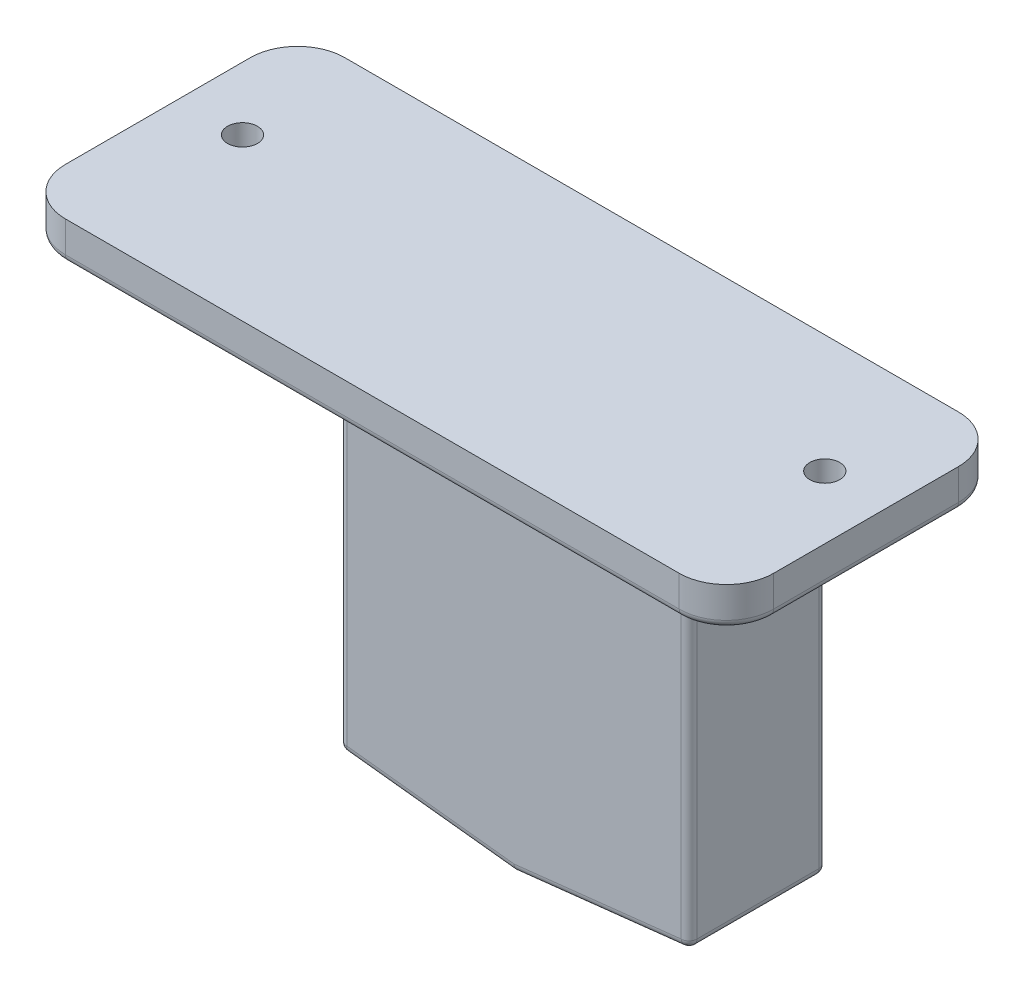
from build123d import *

# Parameters (mm, degrees)
AUFSATZ_LINEAR_AUSTRAGEN1_DEPTH  = 15
SCHNITT_LINEAR_AUSTRAGEN5_DEPTH  = 20.5
SCHNITT_LINEAR_AUSTRAGEN5_DRAFT  = -4
AUFSATZ_LINEAR_AUSTRAGEN4_DEPTH  = 2.5
SKIZZE1_7_W                      = 90
SKIZZE1_7_H                      = 4.944444444
AUFSATZ_LINEAR_AUSTRAGEN5_DEPTH  = 20.5
VERRUNDUNG1_R                    = 8
VERRUNDUNG2_R                    = 6
VERRUNDUNG3_R                    = 1
F_3_8_3_8_DURCHMESSER_BOHRUNG1_D = 3.8


with BuildPart() as part:
    # Skizze1 → Aufsatz-Linear austragen1 (new body)
    with BuildSketch(Plane.XY):
        Polygon((22.25, -56.552393395), (22.25, -2.472222222), (45, -2.472222222), (45, 2.472222222), (-45, 2.472222222), (-45, -2.472222222), (-22.25, -2.472222222), (-22.25, -56.552393395), (0, -59.024615617), align=None)
    extrude(amount=-AUFSATZ_LINEAR_AUSTRAGEN1_DEPTH)


with BuildPart() as schnitt_linear_austragen5_tool:
    # Skizze4 → Schnitt-Linear austragen5 (with draft: the straight prism first)
    with BuildSketch(Plane(origin=(0, 0, -15), x_dir=(-1, 0, 0), z_dir=(0, 0, -1))):
        with BuildLine():
            ThreePointArc((12.810057025, -3.435647478), (0, -2.7261607), (-12.810057025, -3.435647478))
            Line((-12.810057025, -3.435647478), (-20.25, -4.262307808))
            Line((-20.25, -4.262307808), (-20.25, -54.762307808))
            Line((-20.25, -54.762307808), (-12.810057025, -55.588968139))
            ThreePointArc((-12.810057025, -55.588968139), (0, -56.298454917), (12.810057025, -55.588968139))
            Line((12.810057025, -55.588968139), (20.25, -54.762307808))
            Line((20.25, -54.762307808), (20.25, -4.262307808))
            Line((20.25, -4.262307808), (12.810057025, -3.435647478))
        make_face()
    extrude(amount=-SCHNITT_LINEAR_AUSTRAGEN5_DEPTH)
    # Schnitt-Linear austragen5: the draft: its side faces are tilted about the plane it starts from
    schnitt_linear_austragen5_sides = [schnitt_linear_austragen5_tool.faces().sort_by_distance(p)[0] for p in [
        (0, -2.7261607, -4.75),
        (16.530028512, -3.848977643, -4.75),
        (20.25, -29.512307808, -4.75),
        (16.530028512, -55.175637974, -4.75),
        (0, -56.298454917, -4.75),
        (-16.530028512, -55.175637974, -4.75),
        (-20.25, -29.512307808, -4.75),
        (-16.530028512, -3.848977643, -4.75),
    ]]
    draft(schnitt_linear_austragen5_sides, Plane(origin=(0, 0, -15), x_dir=(-1, 0, 0), z_dir=(0, 0, -1)), SCHNITT_LINEAR_AUSTRAGEN5_DRAFT)


with BuildPart() as part_1:
    add(part.part)

    # Schnitt-Linear austragen5: cut by schnitt_linear_austragen5_tool
    add(schnitt_linear_austragen5_tool.part, mode=Mode.SUBTRACT)

    # Skizze1<6> → Aufsatz-Linear austragen4 (add)
    with BuildSketch(Plane.XY):
        Polygon((22.25, -56.552393395), (22.25, -2.472222222), (45, -2.472222222), (45, 2.472222222), (-45, 2.472222222), (-45, -2.472222222), (-22.25, -2.472222222), (-22.25, -56.552393395), (0, -59.024615617), align=None)
    extrude(amount=AUFSATZ_LINEAR_AUSTRAGEN4_DEPTH)

    # Skizze1<7> → Aufsatz-Linear austragen5 (add)
    with BuildSketch(Plane.XY):
        Rectangle(SKIZZE1_7_W, SKIZZE1_7_H)
    extrude(amount=AUFSATZ_LINEAR_AUSTRAGEN5_DEPTH)

    # Verrundung1
    verrundung1_edges = [part_1.edges().sort_by_distance(p)[0] for p in [
        (22.25, -2.472222222, -6.25),
        (0, -2.472222222, 2.5),
        (-22.25, -2.472222222, -6.25),
    ]]
    fillet(verrundung1_edges, radius=VERRUNDUNG1_R)

    # Verrundung2
    verrundung2_edges = [part_1.edges().sort_by_distance(p)[0] for p in [
        (45, 0, -15),
        (-45, 0, -15),
        (45, 0, 20.5),
        (-45, 0, 20.5),
    ]]
    fillet(verrundung2_edges, radius=VERRUNDUNG2_R)

    # Verrundung3
    verrundung3_edges = [part_1.edges().sort_by_distance(p)[0] for p in [
        (-25.081608741, -4.365854088, 5.331608741),
        (25.081608741, -4.365854088, 5.331608741),
        (-22.25, -33.512307808, -15),
        (-24.593145751, -4.815367973, -15),
        (-34.625, -2.472222222, -15),
        (-43.242640687, -2.472222222, -13.242640687),
        (-45, -2.472222222, 2.75),
        (-43.242640687, -2.472222222, 18.742640687),
        (22.25, -33.512307808, -15),
        (24.593145751, -4.815367973, -15),
        (34.625, -2.472222222, -15),
        (43.242640687, -2.472222222, -13.242640687),
        (45, -2.472222222, 2.75),
        (43.242640687, -2.472222222, 18.742640687),
        (11.125, -57.788504506, 2.5),
        (-11.125, -57.788504506, 2.5),
        (-22.25, -33.512307808, 2.5),
        (22.25, -33.512307808, 2.5),
        (11.125, -57.788504506, -15),
        (-11.125, -57.788504506, -15),
        (0, -2.472222222, 20.5),
        (22.25, -56.552393395, -6.25),
        (-22.25, -56.552393395, -6.25),
    ]]
    fillet(verrundung3_edges, radius=VERRUNDUNG3_R)

    # Ø3.8 (3.8) Durchmesser Bohrung1 (through all)
    with Locations(Plane(origin=(-37, -2.472222222, 0), x_dir=(0, 0, -1), z_dir=(0, -1, 0))):
        with Locations((0, 0), (0, 74)):
            Hole(F_3_8_3_8_DURCHMESSER_BOHRUNG1_D / 2)


solid = part_1.part
